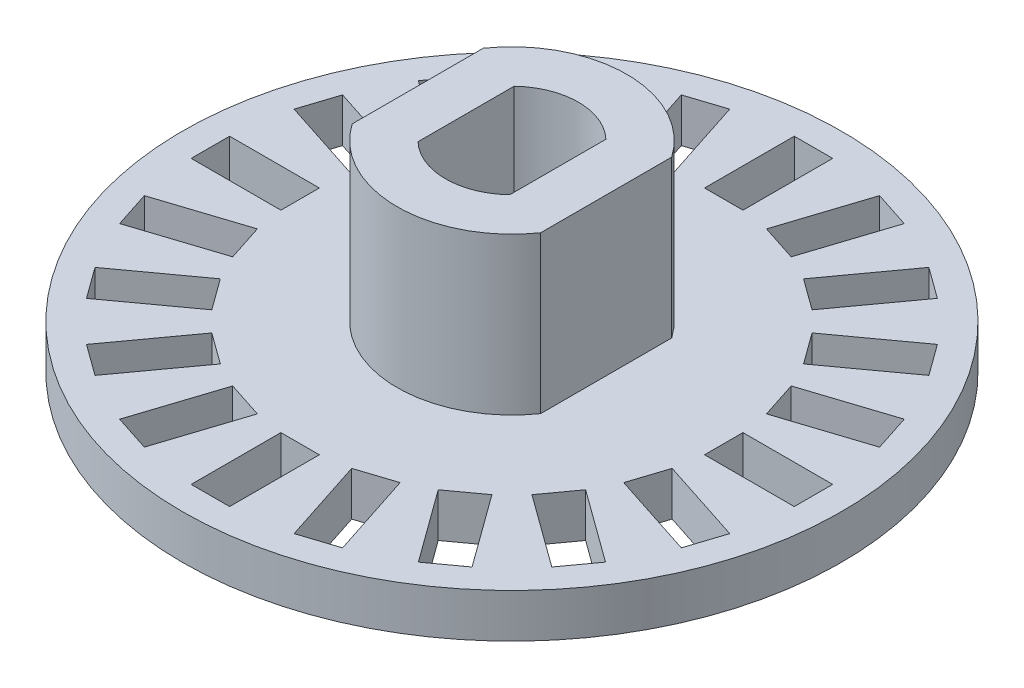
from build123d import *

# Parameters (mm, degrees)
EXTRUS_O1_DEPTH = 8.3
EXTRUS_O2_DEPTH = 7.3
ESCALA3_SCALE   = 1.1
ESBO_O3_R       = 15
EXTRUS_O3_DEPTH = 2
EXTRUS_O4_DEPTH = 23.379385604
ESBO_O5_W       = 4.083358115
ESBO_O5_H       = 1.749439388
ESBO_O5_W_2     = 1.749439388
ESBO_O5_H_2     = 4.083358115
EXTRUS_O5_DEPTH = 2


with BuildPart() as part:
    # Esboço1 → Extrusão1 (new body)
    with BuildSketch(Plane(origin=(0, 0, 0), x_dir=(1, 0, 0), z_dir=(0, 1, 0))):
        with BuildLine():
            Line((3.9, 0), (0, 0))
            Line((0, 0), (-3.9, 0))
            Line((-3.9, 0), (-3.9, -2.711549373))
            ThreePointArc((-3.9, -2.711549373), (0, -4.75), (3.9, -2.711549373))
            Line((3.9, -2.711549373), (3.9, 0))
        make_face()
        with BuildLine():
            Line((-3.9, 0), (0, 0))
            Line((0, 0), (3.9, 0))
            Line((3.9, 0), (3.9, 2.711549373))
            ThreePointArc((3.9, 2.711549373), (0, 4.75), (-3.9, 2.711549373))
            Line((-3.9, 2.711549373), (-3.9, 0))
        make_face()
        with BuildLine():
            Line((-3.9, 0), (0, 0))
            Line((0, 0), (3.9, 0))
            Line((3.9, 0), (3.9, 2.711549373))
            ThreePointArc((3.9, 2.711549373), (0, 4.75), (-3.9, 2.711549373))
            Line((-3.9, 2.711549373), (-3.9, 0))
        make_face()
    extrude(amount=EXTRUS_O1_DEPTH)

    # Esboço2 → Extrusão2 (cut)
    with BuildSketch(Plane(origin=(0, 8.3, 0), x_dir=(1, 0, 0), z_dir=(0, 1, 0))):
        with BuildLine():
            Line((-1.9, 0), (0, 0))
            Line((0, 0), (1.9, 0))
            Line((1.9, 0), (1.9, 1.988089535))
            ThreePointArc((1.9, 1.988089535), (0, 2.75), (-1.9, 1.988089535))
            Line((-1.9, 1.988089535), (-1.9, 0))
        make_face()
        with BuildLine():
            Line((1.9, 0), (0, 0))
            Line((0, 0), (-1.9, 0))
            Line((-1.9, 0), (-1.9, -1.988089535))
            ThreePointArc((-1.9, -1.988089535), (0, -2.75), (1.9, -1.988089535))
            Line((1.9, -1.988089535), (1.9, 0))
        make_face()
    extrude(amount=-EXTRUS_O2_DEPTH, mode=Mode.SUBTRACT)


with BuildPart() as part_1:
    # Escala3: scaled about (0, 0, 0)
    add(part.part.scale(ESCALA3_SCALE))

    # Esboço3 → Extrusão3 (add)
    with BuildSketch(Plane(origin=(0, 0, 0), x_dir=(1, 0, 0), z_dir=(0, 1, 0))):
        with Locations(Location((0, 0, 0), (0, 0, 270))):
            Circle(ESBO_O3_R)
    extrude(amount=EXTRUS_O3_DEPTH)

    # Esboço4 → Extrusão4 (cut, through all)
    with BuildSketch(Plane(origin=(0, 2, 0), x_dir=(1, 0, 0), z_dir=(0, 1, 0))):
        with BuildLine():
            Line((2.09, -2.186898489), (2.09, 2.186898489))
            ThreePointArc((2.09, 2.186898489), (0, 3.025), (-2.09, 2.186898489))
            Line((-2.09, 2.186898489), (-2.09, -2.186898489))
            ThreePointArc((-2.09, -2.186898489), (0, -3.025), (2.09, -2.186898489))
        make_face()
    extrude(amount=-EXTRUS_O4_DEPTH, mode=Mode.SUBTRACT)

    # Esboço5 → Extrusão5 (cut)
    with BuildSketch(Plane.XZ):
        Polygon((-2.14724761, -9.439201012), (-3.409074662, -13.322705355), (-5.072890392, -12.782098853), (-3.81106334, -8.89859451), align=None)
        Polygon((-4.959027358, -8.313677628), (-7.359165037, -11.617183737), (-8.774491233, -10.588889065), (-6.374353553, -7.285382956), align=None)
        Polygon((-7.285382956, -6.374353553), (-10.588889065, -8.774491233), (-11.617183737, -7.359165037), (-8.313677628, -4.959027358), align=None)
        Polygon((3.81106334, -8.89859451), (5.072890392, -12.782098853), (3.409074662, -13.322705355), (2.14724761, -9.439201012), align=None)
        Polygon((6.374353553, -7.285382956), (8.774491233, -10.588889065), (7.359165037, -11.617183737), (4.959027358, -8.313677628), align=None)
        Polygon((8.313677628, -4.959027358), (11.617183737, -7.359165037), (10.588889065, -8.774491233), (7.285382956, -6.374353553), align=None)
        Polygon((9.439201012, -2.14724761), (13.322705355, -3.409074662), (12.782098853, -5.072890392), (8.89859451, -3.81106334), align=None)
        with Locations((11.682428691, 0)):
            Rectangle(ESBO_O5_W, ESBO_O5_H)
        Polygon((8.89859451, 3.81106334), (12.782098853, 5.072890392), (13.322705355, 3.409074662), (9.439201012, 2.14724761), align=None)
        Polygon((4.959027358, 8.313677628), (7.359165037, 11.617183737), (8.774491233, 10.588889065), (6.374353553, 7.285382956), align=None)
        with Locations((0, 11.682428691)):
            Rectangle(ESBO_O5_W_2, ESBO_O5_H_2)
        Polygon((-3.81106334, 8.89859451), (-5.072890392, 12.782098853), (-3.409074662, 13.322705355), (-2.14724761, 9.439201012), align=None)
        with Locations((-11.682428691, 0)):
            Rectangle(ESBO_O5_W, ESBO_O5_H)
        Polygon((-8.89859451, -3.81106334), (-12.782098853, -5.072890392), (-13.322705355, -3.409074662), (-9.439201012, -2.14724761), align=None)
        with Locations((0, -11.682428691)):
            Rectangle(ESBO_O5_W_2, ESBO_O5_H_2)
        Polygon((8.313677628, 4.959027358), (7.285382956, 6.374353553), (10.588889065, 8.774491233), (11.617183737, 7.359165037), align=None)
        Polygon((2.14724761, 9.439201012), (3.409074662, 13.322705355), (5.072890392, 12.782098853), (3.81106334, 8.89859451), align=None)
        Polygon((-7.359165037, 11.617183737), (-8.774491233, 10.588889065), (-6.374353553, 7.285382956), (-4.959027358, 8.313677628), align=None)
        Polygon((-10.588889065, 8.774491233), (-11.617183737, 7.359165037), (-8.313677628, 4.959027358), (-7.285382956, 6.374353553), align=None)
        Polygon((-12.782098853, 5.072890392), (-13.322705355, 3.409074662), (-9.439201012, 2.14724761), (-8.89859451, 3.81106334), align=None)
    extrude(amount=-EXTRUS_O5_DEPTH, mode=Mode.SUBTRACT)


solid = part_1.part
